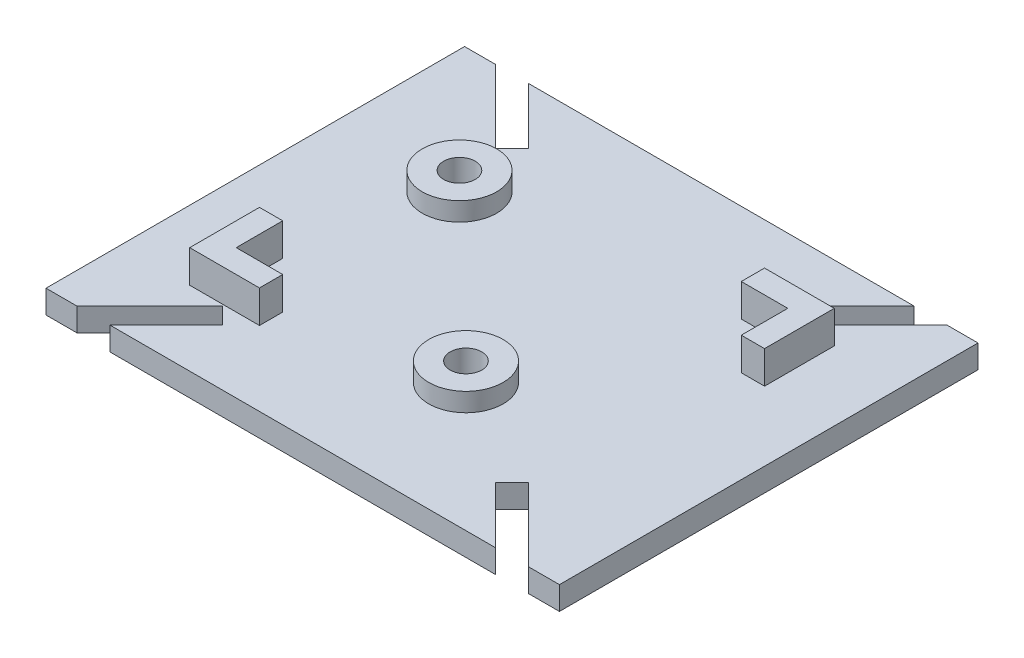
from build123d import *

# Parameters (mm, degrees)
SKETCH3_W            = 55.2
SKETCH3_H            = 45
BOSS_EXTRUDE1_DEPTH  = 1.25
SKETCH4_R            = 4
BOSS_EXTRUDE2_DEPTH  = 2
M3_CLEARANCE_HOLE1_D = 3.4
BOSS_EXTRUDE3_DEPTH  = 3.5
CUT_EXTRUDE1_DEPTH   = 36.780721066
CIRPATTERN1_COUNT    = 4


with BuildPart() as part:
    # Sketch3 → Boss-Extrude1 (new, symmetric)
    with BuildSketch(Plane(origin=(0, 0, 0), x_dir=(1, 0, 0), z_dir=(0, 1, 0))):
        Rectangle(SKETCH3_W, SKETCH3_H)
    extrude(amount=BOSS_EXTRUDE1_DEPTH, both=True)

    # Sketch4 → Boss-Extrude2 (add)
    with BuildSketch(Plane(origin=(0, 1.25, 0), x_dir=(1, 0, 0), z_dir=(0, 1, 0))):
        with Locations((-14.35, 8.7)):
            Circle(SKETCH4_R)
        with Locations((3.75, -8.7)):
            Circle(SKETCH4_R)
    extrude(amount=BOSS_EXTRUDE2_DEPTH)

    # M3 Clearance Hole1 (through all)
    with Locations(Plane(origin=(0, 3.25, 0), x_dir=(1, 0, 0), z_dir=(0, 1, 0))):
        with Locations((-14.35, 8.7), (3.75, -8.7)):
            Hole(M3_CLEARANCE_HOLE1_D / 2)

    # Sketch7 → Boss-Extrude3 (add)
    with BuildSketch(Plane(origin=(0, 1.25, 0), x_dir=(1, 0, 0), z_dir=(0, 1, 0))):
        Polygon((-17.65, -12), (-17.65, -7), (-20.15, -7), (-20.15, -14.5), (-12.65, -14.5), (-12.65, -12), align=None)
        Polygon((17.65, 12), (12.65, 12), (12.65, 14.5), (20.15, 14.5), (20.15, 7), (17.65, 7), align=None)
    extrude(amount=BOSS_EXTRUDE3_DEPTH)

    # Sketch8 → Cut-Extrude1 (cut, symmetric)
    with BuildSketch(Plane(origin=(0, 1.25, 0), x_dir=(1, 0, 0), z_dir=(0, 1, 0))):
        Polygon((-30.32753429, 28.559767337), (-16.440232663, 14.67246571), (-14.67246571, 16.440232663), (-28.559767337, 30.32753429), align=None)
    cut_extrude1 = extrude(amount=CUT_EXTRUDE1_DEPTH, both=True, mode=Mode.SUBTRACT)

    # CirPattern1: Cut-Extrude1 ×4 about axis
    cirpattern1_axis = Axis((0, 50, 0), (0, -1, 0))
    for i in range(1, CIRPATTERN1_COUNT):
        add(cut_extrude1.rotate(cirpattern1_axis, i * 360 / CIRPATTERN1_COUNT), mode=Mode.SUBTRACT)


solid = part.part
